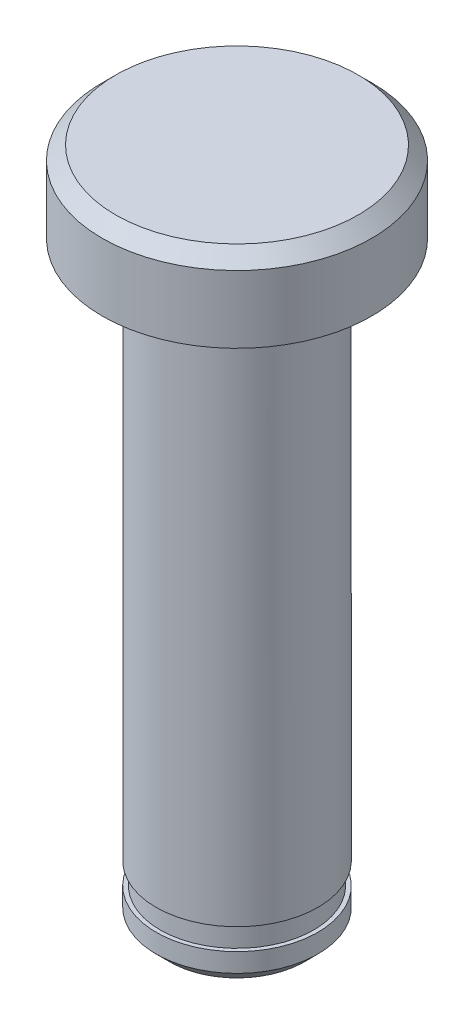
from build123d import *

# Parameters (mm, degrees)
SKETCH1_R           = 5
BOSS_EXTRUDE1_DEPTH = 3
CHAMFER1_SIZE       = 0.5
SKETCH2_R           = 3
BOSS_EXTRUDE2_DEPTH = 22
CHAMFER2_SIZE       = 0.5


with BuildPart() as part:
    # Sketch1 → Boss-Extrude1 (new body)
    with BuildSketch(Plane(origin=(0, 0, 0), x_dir=(-1, 0, 0), z_dir=(0, 1, 0))):
        with Locations(Location((0, 0, 0), (0, 0, 90))):
            Circle(SKETCH1_R)
    extrude(amount=BOSS_EXTRUDE1_DEPTH)

    # Chamfer1
    chamfer1_edges = [part.edges().sort_by_distance(p)[0] for p in [
        (0, 3, -5),
    ]]
    chamfer(chamfer1_edges, length=CHAMFER1_SIZE)

    # Sketch2 → Boss-Extrude2 (add)
    with BuildSketch(Plane.XZ):
        with Locations(Location((0, 0, 0), (0, 0, 270))):
            Circle(SKETCH2_R)
    extrude(amount=BOSS_EXTRUDE2_DEPTH)

    # Chamfer2
    chamfer2_edges = [part.edges().sort_by_distance(p)[0] for p in [
        (0, -22, 3),
    ]]
    chamfer(chamfer2_edges, length=CHAMFER2_SIZE)

    # Sketch3 → Cut-Revolve1 (revolve, cut)
    with BuildSketch(Plane.YZ):
        Polygon((-20.8, 3), (-20.8, 2.85), (-20, 2.85), (-20, 3), (-20, 3.35), (-20.8, 3.35), align=None)
    revolve(axis=Axis((0, 0, 0), (0, -1, 0)), mode=Mode.SUBTRACT)


solid = part.part
